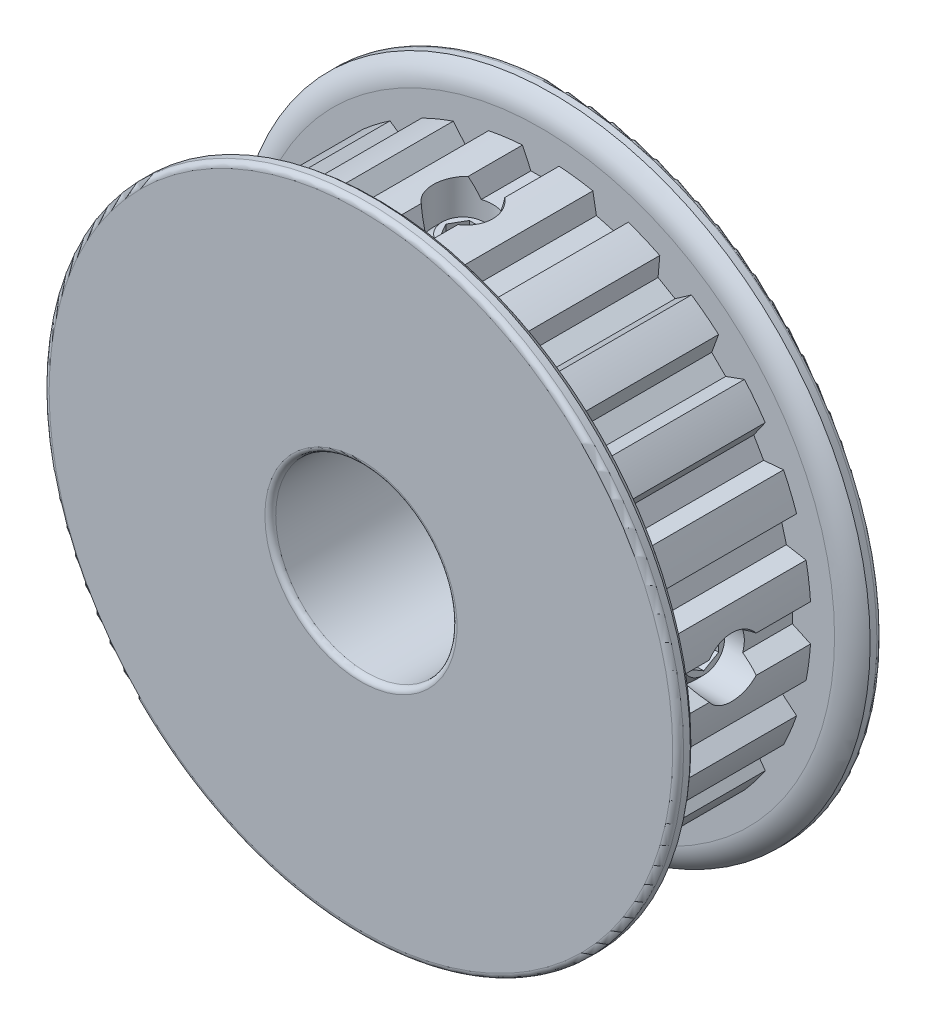
from build123d import *

# Parameters (mm, degrees)
CUT_EXTRUDE1_START = 5.4483
CUT_EXTRUDE1_DEPTH = 10.8966
CIRPATTERN1_COUNT  = 24
FILLET1_R          = 0.381
SKETCH5_R          = 2.0828
CUT_EXTRUDE2_DEPTH = 33.233913576
CUT_EXTRUDE3_DEPTH = 1.0414
CIRPATTERN2_COUNT  = 2
CIRPATTERN2_ANGLE  = 270


with BuildPart() as part:
    # Sketch2 → Revolve1 (revolve)
    with BuildSketch(Plane(origin=(0, 0, 0), x_dir=(0, 0, -1), z_dir=(1, 0, 0)), mode=Mode.PRIVATE) as revolve1_sk:
        with BuildLine():
            Line((-7.1501, 6.35), (7.1501, 6.35))
            Line((7.1501, 6.35), (7.1501, 22.225))
            Line((7.1501, 22.225), (6.2992, 22.225))
            ThreePointArc((6.2992, 22.225), (5.673660763, 21.507711364), (5.4483, 20.583041234))
            Line((5.4483, 20.583041234), (5.4483, 18.941082468))
            Line((5.4483, 18.941082468), (-5.4483, 18.941082468))
            Line((-5.4483, 18.941082468), (-5.4483, 20.583041234))
            ThreePointArc((-5.4483, 20.583041234), (-5.673660763, 21.507711364), (-6.2992, 22.225))
            Line((-6.2992, 22.225), (-7.1501, 22.225))
            Line((-7.1501, 22.225), (-7.1501, 6.35))
        make_face()
    revolve(revolve1_sk.sketch.rotate(Axis((0, 0, 7.1501), (0, 0, -1)), 90), axis=Axis((0, 0, 7.1501), (0, 0, -1)))

    # Sketch3 → Cut-Extrude1 (cut)
    with BuildSketch(Plane.XY.offset(CUT_EXTRUDE1_START)):
        with BuildLine():
            Line((-0.690489274, 17.6276), (0.690489274, 17.6276))
            Line((0.690489274, 17.6276), (1.2827, 18.8976))
            ThreePointArc((1.2827, 18.8976), (0, 18.941082468), (-1.2827, 18.8976))
            Line((-1.2827, 18.8976), (-0.690489274, 17.6276))
        make_face()
    cut_extrude1 = extrude(amount=-CUT_EXTRUDE1_DEPTH, mode=Mode.SUBTRACT)

    # CirPattern1: Cut-Extrude1 ×24 about axis
    cirpattern1_axis = Axis((0, 0, 0), (0, 0, 1))
    for i in range(1, CIRPATTERN1_COUNT):
        add(cut_extrude1.rotate(cirpattern1_axis, i * 360 / CIRPATTERN1_COUNT), mode=Mode.SUBTRACT)

    # Fillet1
    fillet1_edges = [part.edges().sort_by_distance(p)[0] for p in [
        (-22.225, 0, -7.1501),
        (-6.35, 0, -7.1501),
        (-6.35, 0, 7.1501),
        (-22.225, 0, 7.1501),
    ]]
    fillet(fillet1_edges, radius=FILLET1_R)

    # Sketch5 → Cut-Extrude2 (cut, through all)
    with BuildSketch(Plane(origin=(0, 0, 0), x_dir=(1, 0, 0), z_dir=(0, 1, 0))):
        with Locations(Location((0, 0, 0), (0, 0, 90))):
            Circle(SKETCH5_R)
    cut_extrude2 = extrude(amount=CUT_EXTRUDE2_DEPTH, mode=Mode.SUBTRACT)

    # Sketch6 → Revolve2 (revolve)
    with BuildSketch(Plane(origin=(0, 0, 0), x_dir=(0, 0, -1), z_dir=(1, 0, 0)), mode=Mode.PRIVATE) as revolve2_sk:
        Polygon((0, 16.8656), (0, 7.112), (-1.45796, 7.112), (-2.0828, 7.73684), (-2.0828, 16.24076), (-1.45796, 16.8656), align=None)
    revolve2 = revolve(revolve2_sk.sketch.rotate(Axis((0, 16.8656, 0), (0, -1, 0)), 180), axis=Axis((0, 16.8656, 0), (0, -1, 0)))

    # Sketch7 → Cut-Extrude3 (cut)
    with BuildSketch(Plane(origin=(0, 16.8656, 0), x_dir=(1, 0, 0), z_dir=(0, 1, 0))):
        Polygon((1.202505141, 0), (0.60125257, 1.0414), (-0.60125257, 1.0414), (-1.202505141, 0), (-0.60125257, -1.0414), (0.60125257, -1.0414), align=None)
    cut_extrude3 = extrude(amount=-CUT_EXTRUDE3_DEPTH, mode=Mode.SUBTRACT)

    # CirPattern2: Cut-Extrude2, Revolve2, Cut-Extrude3 ×2 about axis
    cirpattern2_axis = Axis((0, 0, 0), (0, 0, 1))
    add([cut_extrude2.rotate(cirpattern2_axis, i * CIRPATTERN2_ANGLE / (CIRPATTERN2_COUNT - 1)) for i in range(1, CIRPATTERN2_COUNT)], mode=Mode.SUBTRACT)
    add([revolve2.rotate(cirpattern2_axis, i * CIRPATTERN2_ANGLE / (CIRPATTERN2_COUNT - 1)) for i in range(1, CIRPATTERN2_COUNT)])
    add([cut_extrude3.rotate(cirpattern2_axis, i * CIRPATTERN2_ANGLE / (CIRPATTERN2_COUNT - 1)) for i in range(1, CIRPATTERN2_COUNT)], mode=Mode.SUBTRACT)


solid = part.part
